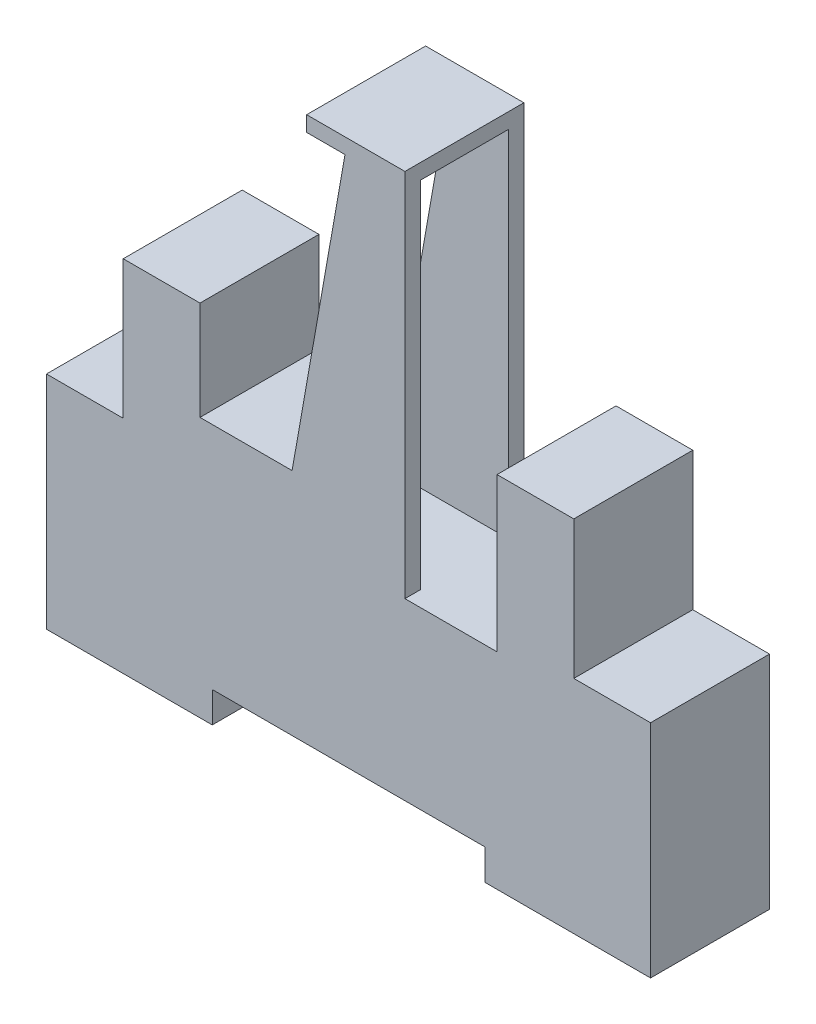
from build123d import *

# Parameters (mm, degrees)
BOSS_EXTRU_1_DEPTH      = 15.5
ENL_V_START             = -2
ESQUISSE2_W             = 17.606783298
ESQUISSE2_H             = 46.2
ENL_V_MAT_EXTRU_1_DEPTH = 11.5
ENL_V_MAT_EXTRU_2_REACH = 88.103
ESQUISSE3_R             = 1.6


with BuildPart() as part:
    # Esquisse1 → Boss.-Extru.1 (new body)
    with BuildSketch(Plane.XY):
        Polygon((-39.35, 0), (-39.35, 28.8), (-29.35, 28.8), (-29.35, 46.8), (-19.35, 46.8), (-19.35, 33.9), (-7.35, 33.9), (-0.455615054, 73), (-5.455615054, 73), (-5.455615054, 75), (7.35, 75), (7.35, 26.8), (19.35, 26.8), (19.35, 46.8), (29.35, 46.8), (29.35, 28.8), (39.35, 28.8), (39.35, 0), (17.75, 0), (17.75, 4), (-17.75, 4), (-17.75, 0), align=None)
    extrude(amount=BOSS_EXTRU_1_DEPTH)

    # Esquisse2 → Enlèv. mat.-Extru.1 (cut)
    with BuildSketch(Plane.XY.offset(15.5).offset(ENL_V_START)):
        with Locations((1.453391649, 49.9)):
            Rectangle(ESQUISSE2_W, ESQUISSE2_H)
    extrude(amount=-ENL_V_MAT_EXTRU_1_DEPTH, mode=Mode.SUBTRACT)

    # Esquisse3 → Enlèv. mat.-Extru.2 (cut, up to next)
    with BuildSketch(Plane.XZ, mode=Mode.PRIVATE) as enl_v_mat_extru_2_sk1:
        with Locations(Location((-1.65, 7.75, 0), (0, 0, 270))):
            Circle(ESQUISSE3_R)
    enl_v_mat_extru_2_tool1 = extrude(enl_v_mat_extru_2_sk1.sketch, amount=-ENL_V_MAT_EXTRU_2_REACH, mode=Mode.PRIVATE) & part.part
    add(enl_v_mat_extru_2_tool1.solids().sort_by_distance((-1.65, 0, 7.75))[0], mode=Mode.SUBTRACT)


solid = part.part
